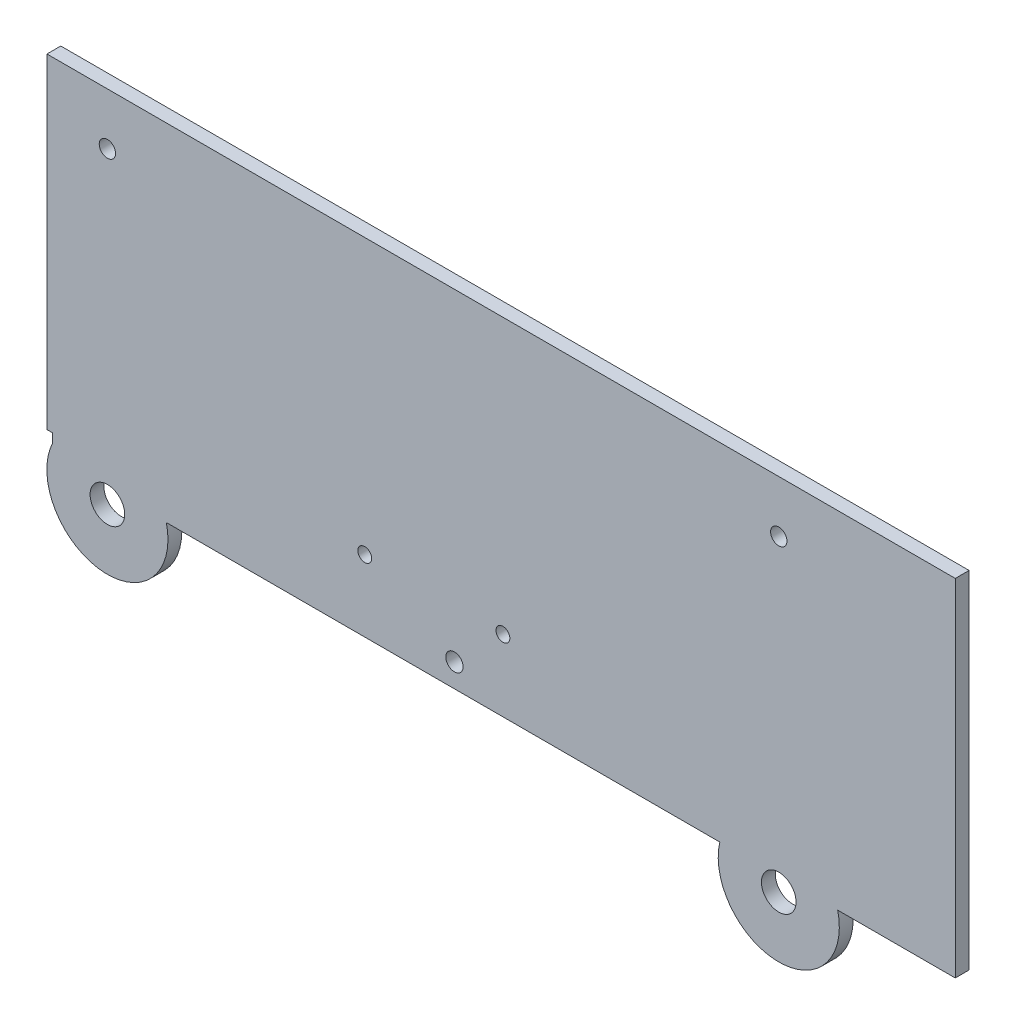
from build123d import *

# Parameters (mm, degrees)
BOSS_EXTRUDE1_DEPTH = 5.07492
SKETCH5_W           = 44.45
SKETCH5_H           = 127
BOSS_EXTRUDE2_DEPTH = 5.07492
SKETCH6_R           = 22.225
BOSS_EXTRUDE3_DEPTH = 5.07492
SKETCH2_3_R         = 6.35
CUT_EXTRUDE2_DEPTH  = 5.588
SKETCH8_W           = 2.728150378
SKETCH8_H           = 119.38
BOSS_EXTRUDE4_DEPTH = 5.07492
SKETCH9_R           = 3
CUT_EXTRUDE3_DEPTH  = 400.05
SKETCH10_R          = 2.54
SKETCH10_R_2        = 3.175
CUT_EXTRUDE4_DEPTH  = 6.35


with BuildPart() as part:
    # Sketch2 → Boss-Extrude1 (new body)
    with BuildSketch(Plane.XY):
        with BuildLine():
            Line((-143.383, -31.75), (-127.127, -31.75))
            ThreePointArc((-127.127, -31.75), (-123.317, -30.48), (-119.507, -31.75))
            Line((-119.507, -31.75), (119.253, -31.75))
            ThreePointArc((119.253, -31.75), (123.063, -30.48), (126.873, -31.75))
            Line((126.873, -31.75), (143.383, -31.75))
            Line((143.383, -31.75), (143.383, 95.25))
            Line((143.383, 95.25), (-143.383, 95.25))
            Line((-143.383, 95.25), (-143.383, -31.75))
        make_face()
    extrude(amount=-BOSS_EXTRUDE1_DEPTH)

    # Sketch5 → Boss-Extrude2 (add)
    with BuildSketch(Plane(origin=(0, 0, -5.07492), x_dir=(-1, 0, 0), z_dir=(0, 0, -1))):
        with Locations((-165.608, 31.75)):
            Rectangle(SKETCH5_W, SKETCH5_H)
    extrude(amount=-BOSS_EXTRUDE2_DEPTH)

    # Sketch6 → Boss-Extrude3 (add)
    with BuildSketch(Plane(origin=(0, 0, -5.07492), x_dir=(-1, 0, 0), z_dir=(0, 0, -1))):
        with Locations((-123.063, -36.83)):
            Circle(SKETCH6_R)
        with Locations((123.317, -36.83)):
            Circle(SKETCH6_R)
    extrude(amount=-BOSS_EXTRUDE3_DEPTH)

    # Sketch2<3> → Cut-Extrude2 (cut)
    with BuildSketch(Plane.XY):
        with Locations((-123.317, -36.83)):
            Circle(SKETCH2_3_R)
        with Locations((123.063, -36.83)):
            Circle(SKETCH2_3_R)
    extrude(amount=-CUT_EXTRUDE2_DEPTH, mode=Mode.SUBTRACT)

    # Sketch8 → Boss-Extrude4 (add)
    with BuildSketch(Plane(origin=(0, 0, -5.07492), x_dir=(-1, 0, 0), z_dir=(0, 0, -1))):
        with Locations((144.139824811, 35.56)):
            Rectangle(SKETCH8_W, SKETCH8_H)
    extrude(amount=-BOSS_EXTRUDE4_DEPTH)

    # Sketch9 → Cut-Extrude3 (cut)
    with BuildSketch(Plane(origin=(0, 0, -5.07492), x_dir=(-1, 0, 0), z_dir=(0, 0, -1))):
        with Locations((-123.063, 76.2)):
            Circle(SKETCH9_R)
        with Locations((123.317, 76.2)):
            Circle(SKETCH9_R)
    extrude(amount=-CUT_EXTRUDE3_DEPTH, mode=Mode.SUBTRACT)

    # Sketch10 → Cut-Extrude4 (cut)
    with BuildSketch(Plane(origin=(0, 0, -5.07492), x_dir=(-1, 0, 0), z_dir=(0, 0, -1))):
        with Locations((-21.82866276, -5.525633542)):
            Circle(SKETCH10_R)
        with Locations((-4.046637407, -23.177780468)):
            Circle(SKETCH10_R_2)
        with Locations((28.869618805, -5.525633542)):
            Circle(SKETCH10_R)
    extrude(amount=-CUT_EXTRUDE4_DEPTH, mode=Mode.SUBTRACT)


solid = part.part
